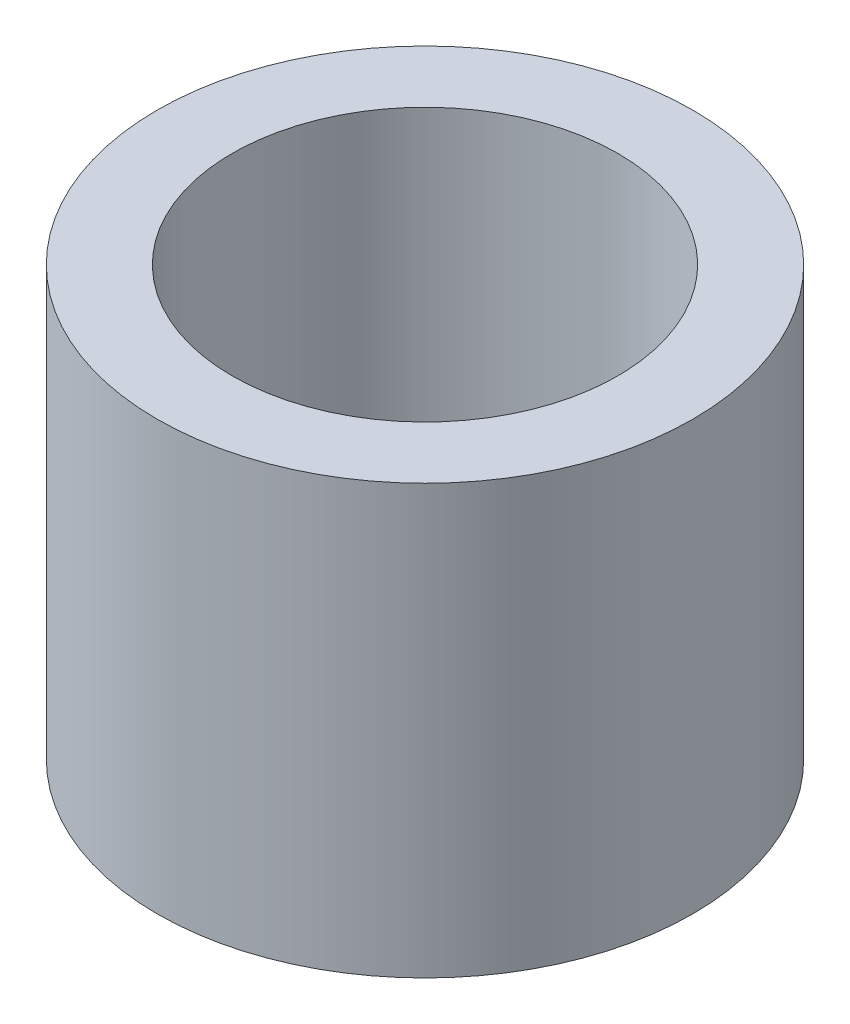
from build123d import *

# Parameters (mm, degrees)
SKETCH1_R           = 3.175
BOSS_EXTRUDE1_DEPTH = 5.08
SKETCH3_R           = 2.286
CUT_EXTRUDE1_DEPTH  = 5.08


with BuildPart() as part:
    # Sketch1 → Boss-Extrude1 (new body)
    with BuildSketch(Plane(origin=(0, 0, 0), x_dir=(1, 0, 0), z_dir=(0, 1, 0))):
        with Locations(Location((0, 0, 0), (0, 0, 270))):
            Circle(SKETCH1_R)
    extrude(amount=BOSS_EXTRUDE1_DEPTH)

    # Sketch3 → Cut-Extrude1 (cut)
    with BuildSketch(Plane.XZ):
        with Locations(Location((0, 0, 0), (0, 0, 270))):
            Circle(SKETCH3_R)
    extrude(amount=-CUT_EXTRUDE1_DEPTH, mode=Mode.SUBTRACT)


solid = part.part
